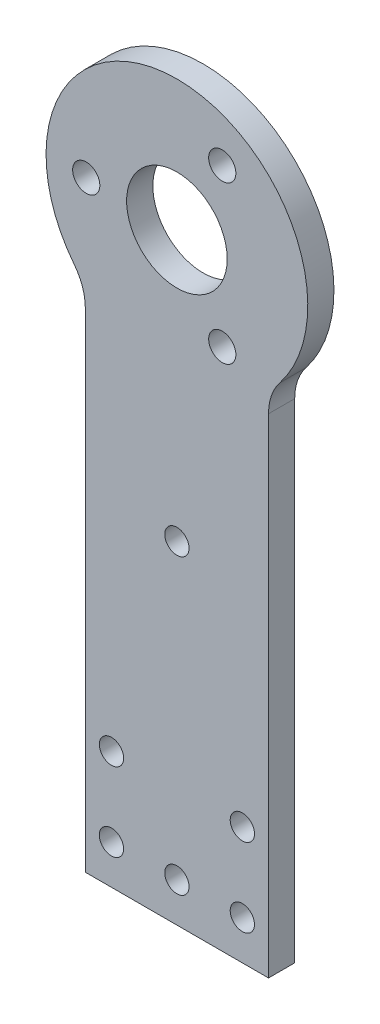
from build123d import *

# Parameters (mm, degrees)
SKETCH1_R                 = 1.65
SKETCH1_R_2               = 6.1
BOSS_EXTRUDE1_DEPTH       = 3.175
F_4_CLEARANCE_HOLE2_D     = 2.9464
F_4_CLEARANCE_HOLE2_DEPTH = 9.906
F_4_CLEARANCE_HOLE2_TIP   = 0.885187864
F_4_CLEARANCE_HOLE1_D     = 2.9464
FILLET1_R                 = 6.35


with BuildPart() as part:
    # Sketch1 → Boss-Extrude1 (new body)
    with BuildSketch(Plane.XY):
        with BuildLine():
            Line((-11.1125, -11.33701763), (-11.1125, -73.025))
            Line((-11.1125, -73.025), (11.1125, -73.025))
            Line((11.1125, -73.025), (11.1125, -11.33701763))
            ThreePointArc((11.1125, -11.33701763), (0, 15.875), (-11.1125, -11.33701763))
        make_face()
        with Locations((-11, 0)):
            Circle(SKETCH1_R, mode=Mode.SUBTRACT)
        with Locations((5.5, 9.526279442)):
            Circle(SKETCH1_R, mode=Mode.SUBTRACT)
        with Locations((5.5, -9.526279442)):
            Circle(SKETCH1_R, mode=Mode.SUBTRACT)
        Circle(SKETCH1_R_2, mode=Mode.SUBTRACT)
    extrude(amount=BOSS_EXTRUDE1_DEPTH)

    # #4 Clearance Hole2
    with Locations(Plane(origin=(0, 0, 0), x_dir=(-1, 0, 0), z_dir=(0, 0, -1))):
        with Locations((7.9375, -68.2625), (-7.9375, -68.2625), (-7.9375, -58.7375), (7.9375, -58.7375)):
            Hole(F_4_CLEARANCE_HOLE2_D / 2, depth=F_4_CLEARANCE_HOLE2_DEPTH)
            with Locations((0, 0, -(F_4_CLEARANCE_HOLE2_DEPTH + F_4_CLEARANCE_HOLE2_TIP / 2))):  # 118° drill point
                Cone(0, F_4_CLEARANCE_HOLE2_D / 2, F_4_CLEARANCE_HOLE2_TIP, mode=Mode.SUBTRACT)

    # #4 Clearance Hole1 (through all)
    with Locations(Plane(origin=(0, 0, 0), x_dir=(-1, 0, 0), z_dir=(0, 0, -1))):
        with Locations((0, -68.2625), (0, -32.7025)):
            Hole(F_4_CLEARANCE_HOLE1_D / 2)

    # Fillet1
    fillet1_edges = [part.edges().sort_by_distance(p)[0] for p in [
        (11.1125, -11.33701763, 1.5875),
        (-11.1125, -11.33701763, 1.5875),
    ]]
    fillet(fillet1_edges, radius=FILLET1_R)


solid = part.part
